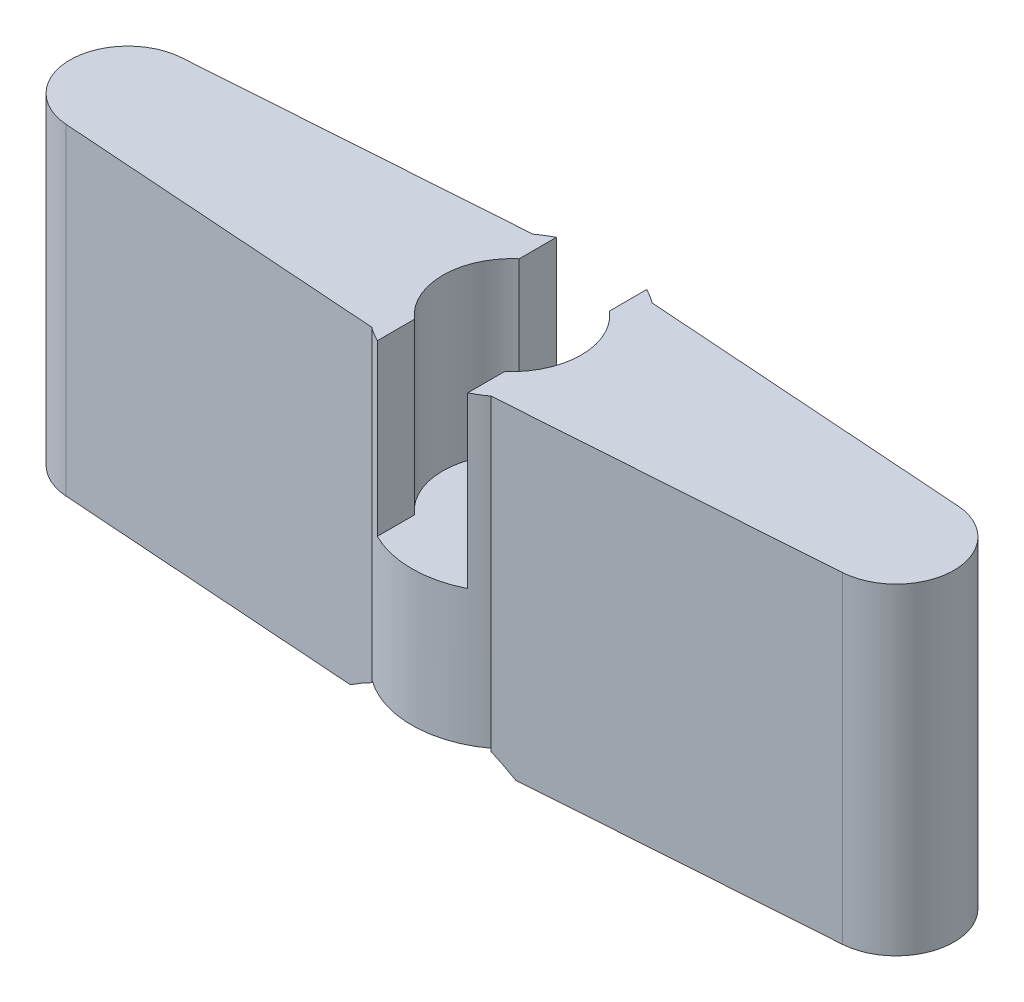
from build123d import *

# Parameters (mm, degrees)
BOSS_EXTRUDE1_DEPTH = 11.4
CUT_EXTRUDE1_DEPTH  = 0.6
CHAMFER1_SIZE       = 0.5
CUT_EXTRUDE2_DEPTH  = 6


with BuildPart() as part:
    # Sketch2 → Boss-Extrude1 (new body)
    with BuildSketch(Plane(origin=(0, 0, 0), x_dir=(1, 0, 0), z_dir=(0, 1, 0))):
        with BuildLine():
            Line((-13.742133053, -2.045066795), (-2.112067201, -2.853361551))
            ThreePointArc((-2.112067201, -2.853361551), (0, -3.55), (2.112067201, -2.853361551))
            Line((2.112067201, -2.853361551), (13.742133053, -2.045066795))
            ThreePointArc((13.742133053, -2.045066795), (15.65, 0), (13.742133053, 2.045066795))
            Line((13.742133053, 2.045066795), (2.112067201, 2.853361551))
            ThreePointArc((2.112067201, 2.853361551), (0, 3.55), (-2.112067201, 2.853361551))
            Line((-2.112067201, 2.853361551), (-13.742133053, 2.045066795))
            ThreePointArc((-13.742133053, 2.045066795), (-15.65, 0), (-13.742133053, -2.045066795))
        make_face()
    extrude(amount=BOSS_EXTRUDE1_DEPTH)

    # Sketch3 → Cut-Extrude1 (cut)
    with BuildSketch(Plane.XZ):
        with BuildLine():
            ThreePointArc((-2.112067201, 2.853361551), (0, -3.55), (2.112067201, 2.853361551))
            ThreePointArc((2.112067201, 2.853361551), (0, 3.55), (-2.112067201, 2.853361551))
        make_face()
    extrude(amount=-CUT_EXTRUDE1_DEPTH, mode=Mode.SUBTRACT)

    # Chamfer1
    chamfer1_edges = [part.edges().sort_by_distance(p)[0] for p in [
        (-3.55, 0, 0),
        (3.55, 0, 0),
    ]]
    chamfer(chamfer1_edges, length=CHAMFER1_SIZE)

    # Shaft Key → Cut-Extrude2 (cut)
    with BuildSketch(Plane(origin=(0, 11.4, 0), x_dir=(1, 0, 0), z_dir=(0, 1, 0))):
        with BuildLine():
            Line((1.6, -1.855397532), (1.6, -5.45))
            Line((1.6, -5.45), (-1.6, -5.45))
            Line((-1.6, -5.45), (-1.6, -1.855397532))
            ThreePointArc((-1.6, -1.855397532), (-2.45, 0), (-1.6, 1.855397532))
            Line((-1.6, 1.855397532), (-1.6, 5.45))
            Line((-1.6, 5.45), (1.6, 5.45))
            Line((1.6, 5.45), (1.6, 1.855397532))
            ThreePointArc((1.6, 1.855397532), (2.45, 0), (1.6, -1.855397532))
        make_face()
    extrude(amount=-CUT_EXTRUDE2_DEPTH, mode=Mode.SUBTRACT)


solid = part.part
